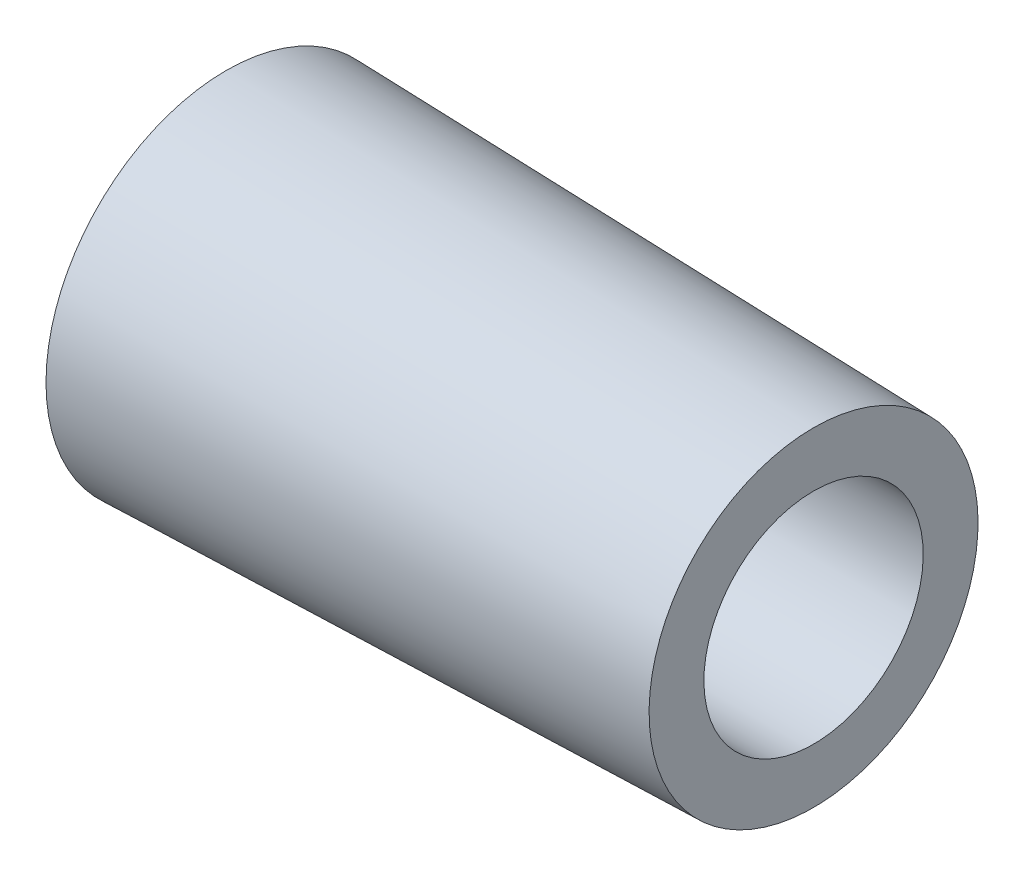
from build123d import *

# Parameters (mm, degrees)
REVOLVE1_ANGLE = 359.999999589


with BuildPart() as part:
    # Sketch1 → Revolve1 (revolve)
    with BuildSketch(Plane.XY):
        Polygon((1900, 280), (1900, 460), (3400, 420), (3400, 280), align=None)
    revolve(axis=Axis((0, 0, 0), (1, 0, 0)), revolution_arc=REVOLVE1_ANGLE)


solid = part.part
